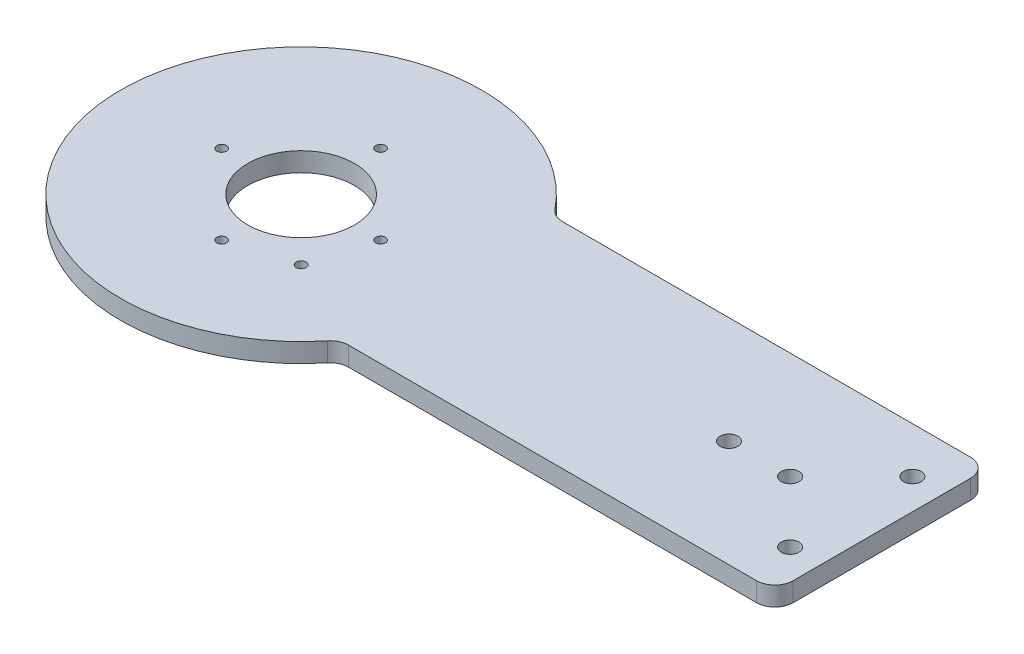
from build123d import *

# Parameters (mm, degrees)
BOSS_EXTRUDE1_DEPTH     = 7.9375
SKETCH21_R              = 22.1615
SKETCH21_R_2            = 2.0193
CUT_EXTRUDE2_DEPTH      = 253.811910138
FILLET1_R               = 7.62
L_0_29_DIAMETER_HOLE1_D = 7.366


with BuildPart() as part:
    # Sketch1 → Boss-Extrude1 (new body)
    with BuildSketch(Plane(origin=(0, 0, 0), x_dir=(1, 0, 0), z_dir=(0, 1, 0))):
        with BuildLine():
            Line((241.3, -44.45), (60.409978491, -44.45))
            ThreePointArc((60.409978491, -44.45), (-75.00112, 0), (60.409978491, 44.45))
            Line((60.409978491, 44.45), (241.3, 44.45))
            Line((241.3, 44.45), (241.3, -44.45))
        make_face()
    extrude(amount=BOSS_EXTRUDE1_DEPTH)

    # Sketch21 → Cut-Extrude2 (cut, through all)
    with BuildSketch(Plane(origin=(0, 7.9375, 0), x_dir=(1, 0, 0), z_dir=(0, 1, 0))):
        with Locations(Location((0, 0, 0), (0, 0, 270))):
            Circle(SKETCH21_R)
        with Locations(Location((0, 33.02, 0), (0, 0, 270))):
            Circle(SKETCH21_R_2)
        with Locations(Location((-33.02, 0, 0), (0, 0, 270))):
            Circle(SKETCH21_R_2)
        with Locations(Location((0, -33.02, 0), (0, 0, 270))):
            Circle(SKETCH21_R_2)
        with Locations(Location((33.02, 0, 0), (0, 0, 270))):
            Circle(SKETCH21_R_2)
        with Locations(Location((25.4, -25.4, 0), (0, 0, 270))):
            Circle(SKETCH21_R_2)
    extrude(amount=-CUT_EXTRUDE2_DEPTH, mode=Mode.SUBTRACT)

    # Fillet1
    fillet1_edges = [part.edges().sort_by_distance(p)[0] for p in [
        (60.409978491, 3.96875, -44.45),
        (241.3, 3.96875, -44.45),
        (241.3, 3.96875, 44.45),
        (60.409978491, 3.96875, 44.45),
    ]]
    fillet(fillet1_edges, radius=FILLET1_R)

    # L (0.29) Diameter Hole1 (through all)
    with Locations(Plane(origin=(0, 7.9375, 0), x_dir=(1, 0, 0), z_dir=(0, 1, 0))):
        with Locations((228.6, 25.4), (228.6, -25.4), (203.2, 0), (177.8, 0)):
            Hole(L_0_29_DIAMETER_HOLE1_D / 2)


solid = part.part
